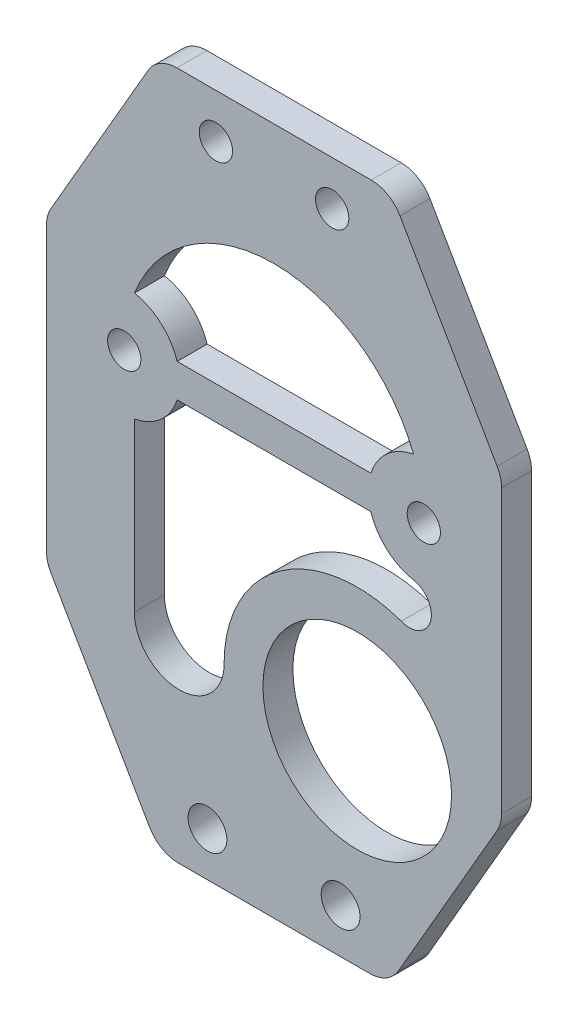
from build123d import *

# Parameters (mm, degrees)
SKETCH1_R           = 1.75
SKETCH1_R_2         = 8.5
SKETCH1_R_3         = 1.5
BOSS_EXTRUDE1_DEPTH = 2.7
FILLET1_R           = 3


with BuildPart() as part:
    # Sketch1 → Boss-Extrude1 (new body)
    with BuildSketch(Plane.XY):
        with BuildLine():
            Line((10.487675588, 31), (-10.487675588, 31))
            Line((-10.487675588, 31), (-20.108076211, 14.336977332))
            ThreePointArc((-20.108076211, 14.336977332), (-20.407777479, 13.613434467), (-20.51, 12.836977332))
            Line((-20.51, 12.836977332), (-20.51, -12.596152423))
            ThreePointArc((-20.51, -12.596152423), (-20.407777479, -13.372609558), (-20.108076211, -14.096152423))
            Line((-20.108076211, -14.096152423), (-10.348635262, -31))
            Line((-10.348635262, -31), (10.348635262, -31))
            Line((10.348635262, -31), (20.108076211, -14.096152423))
            ThreePointArc((20.108076211, -14.096152423), (20.407777479, -13.372609558), (20.51, -12.596152423))
            Line((20.51, -12.596152423), (20.51, 12.836977332))
            ThreePointArc((20.51, 12.836977332), (20.407777479, 13.613434467), (20.108076211, 14.336977332))
            Line((20.108076211, 14.336977332), (10.487675588, 31))
        make_face()
        with Locations(Location((-6, -27, 0), (0, 0, 180))):
            Circle(SKETCH1_R, mode=Mode.SUBTRACT)
        with Locations(Location((6, -27, 0), (0, 0, 180))):
            Circle(SKETCH1_R, mode=Mode.SUBTRACT)
        with Locations(Location((7.5, -13.4, 0), (0, 0, 180))):
            Circle(SKETCH1_R_2, mode=Mode.SUBTRACT)
        with BuildLine():
            ThreePointArc((-4.5, -13.4), (-8.54, -17.44), (-12.58, -13.4))
            Line((-12.58, -13.4), (-12.58, 1.685368783))
            ThreePointArc((-12.58, 1.685368783), (-10.18215631, 2.859423407), (-8.730303993, 5.1))
            Line((-8.730303993, 5.1), (8.729875369, 5.1))
            ThreePointArc((8.729875369, 5.1), (10.179804764, 2.860963681), (12.574584064, 1.685969643))
            ThreePointArc((12.574584064, 1.685969643), (14.121431526, -0.726790857), (11.622623122, -2.13039581))
            ThreePointArc((11.622623122, -2.13039581), (11.545720037, -2.104624526), (11.469942926, -2.075709596))
            ThreePointArc((11.469942926, -2.075709596), (0.558793877, -3.611248417), (-4.5, -13.4))
        make_face(mode=Mode.SUBTRACT)
        with Locations(Location((-13.5, 6.6, 0), (0, 0, 180))):
            Circle(SKETCH1_R_3, mode=Mode.SUBTRACT)
        with BuildLine():
            Line((8.729875369, 8.1), (-8.730303993, 8.1))
            ThreePointArc((-8.730303993, 8.1), (-10.179901517, 10.338575405), (-12.574074074, 11.513518208))
            ThreePointArc((-12.574074074, 11.513518208), (-0.00020804, 20.099999998), (12.57392263, 11.513905748))
            ThreePointArc((12.57392263, 11.513905748), (10.179553129, 10.338812856), (8.729875369, 8.1))
        make_face(mode=Mode.SUBTRACT)
        with Locations(Location((-5.24, 27, 0), (0, 0, 180))):
            Circle(SKETCH1_R_3, mode=Mode.SUBTRACT)
        with Locations(Location((13.5, 6.6, 0), (0, 0, 180))):
            Circle(SKETCH1_R_3, mode=Mode.SUBTRACT)
        with Locations(Location((5.24, 27, 0), (0, 0, 180))):
            Circle(SKETCH1_R_3, mode=Mode.SUBTRACT)
    extrude(amount=BOSS_EXTRUDE1_DEPTH)

    # Fillet1
    fillet1_edges = [part.edges().sort_by_distance(p)[0] for p in [
        (-10.487675588, 31, 1.35),
        (10.487675588, 31, 1.35),
        (10.348635262, -31, 1.35),
        (-10.348635262, -31, 1.35),
    ]]
    fillet(fillet1_edges, radius=FILLET1_R)


solid = part.part
